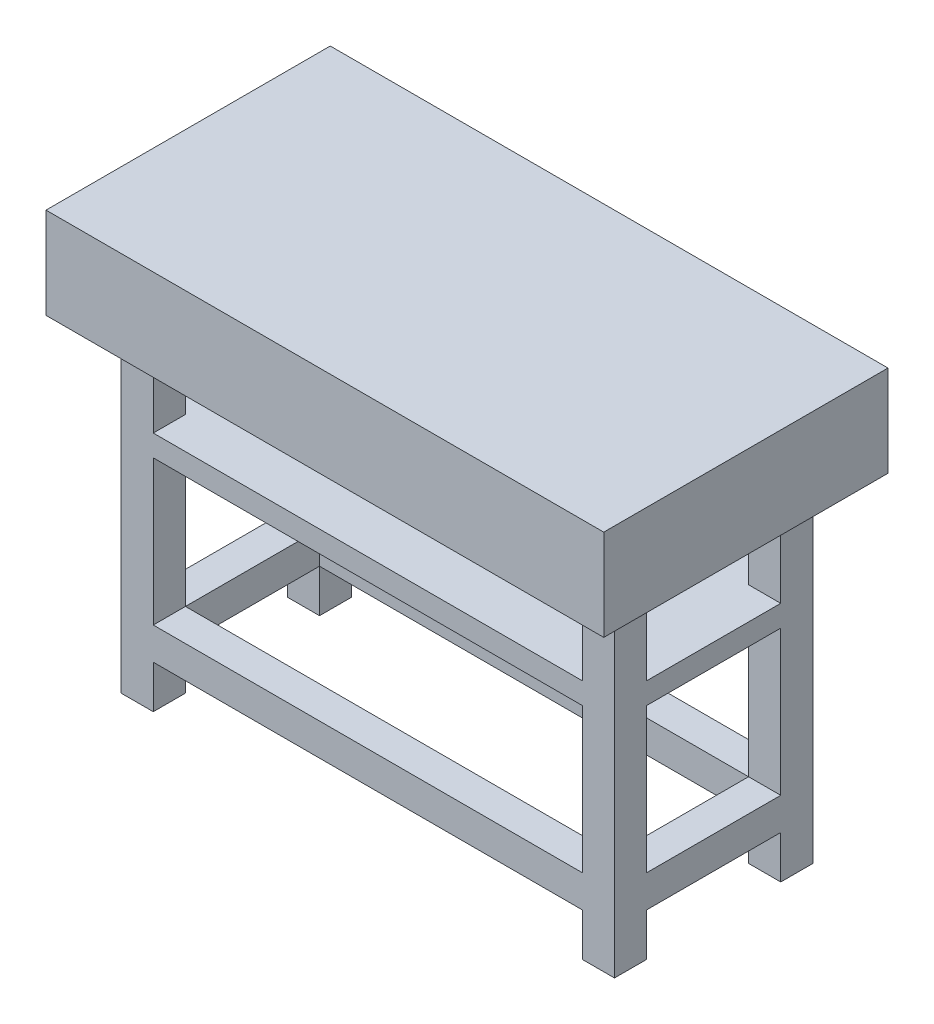
from build123d import *

# Parameters (mm, degrees)
SKETCH_2_W      = 1040
SKETCH_2_H      = 530
EXTRUDE_1_DEPTH = 170
SKETCH_3_W      = 800
SKETCH_3_H      = 60
SKETCH_3_W_2    = 60
SKETCH_3_H_2    = 410
EXTRUDE_2_DEPTH = 60
SKETCH_4_W      = 60
SKETCH_4_H      = 60
EXTRUDE_3_DEPTH = 560
EXTRUDE_4_REACH = 1274.046
SKETCH_5_W      = 60
SKETCH_5_H      = 60
SKETCH_5_H_2    = 40
EXTRUDE_5_REACH = 1231.512
SKETCH_6_W      = 60
SKETCH_6_H      = 60
EXTRUDE_6_REACH = 1231.512
SKETCH_7_W      = 370
SKETCH_7_H      = 40


with BuildPart() as part:
    # ｽｹｯﾁ2 → ﾎﾞｽ - 押し出し1 (new body)
    with BuildSketch(Plane(origin=(0, 0, 0), x_dir=(1, 0, 0), z_dir=(0, 1, 0))):
        with Locations((520, 265)):
            Rectangle(SKETCH_2_W, SKETCH_2_H)
    extrude(amount=EXTRUDE_1_DEPTH)

    # ｽｹｯﾁ3 → ﾎﾞｽ - 押し出し2 (add)
    with BuildSketch(Plane(origin=(0, 0, 0), x_dir=(-1, 0, 0), z_dir=(0, -1, 0))):
        with Locations((-520, 420)):
            Rectangle(SKETCH_3_W, SKETCH_3_H)
        with Locations((-950, 265)):
            Rectangle(SKETCH_3_W_2, SKETCH_3_H_2)
        with Locations((-520, 110)):
            Rectangle(SKETCH_3_W, SKETCH_3_H)
        with Locations((-90, 265)):
            Rectangle(SKETCH_3_W_2, SKETCH_3_H_2)
    extrude(amount=EXTRUDE_2_DEPTH)

    # ｽｹｯﾁ4 → ﾎﾞｽ - 押し出し3 (add)
    with BuildSketch(Plane(origin=(0, -60, 0), x_dir=(-1, 0, 0), z_dir=(0, -1, 0))):
        with Locations((-950, 420)):
            Rectangle(SKETCH_4_W, SKETCH_4_H)
        with Locations((-950, 110)):
            Rectangle(SKETCH_4_W, SKETCH_4_H)
        with Locations((-90, 420)):
            Rectangle(SKETCH_4_W, SKETCH_4_H)
        with Locations((-90, 110)):
            Rectangle(SKETCH_4_W, SKETCH_4_H)
    extrude(amount=EXTRUDE_3_DEPTH)

    # ｽｹｯﾁ5 → ﾎﾞｽ - 押し出し4 (add, up to next)
    with BuildSketch(Plane(origin=(0, 0, -140), x_dir=(-1, 0, 0), z_dir=(0, 0, -1)), mode=Mode.PRIVATE) as extrude_4_sk1:
        with Locations((-90, -510)):
            Rectangle(SKETCH_5_W, SKETCH_5_H)
    extrude_4_tool1 = extrude(extrude_4_sk1.sketch, amount=EXTRUDE_4_REACH, mode=Mode.PRIVATE) - part.part
    # ｽｹｯﾁ5 → ﾎﾞｽ - 押し出し4 (add, up to next)
    with BuildSketch(Plane(origin=(0, 0, -140), x_dir=(-1, 0, 0), z_dir=(0, 0, -1)), mode=Mode.PRIVATE) as extrude_4_sk2:
        with Locations((-950, -510)):
            Rectangle(SKETCH_5_W, SKETCH_5_H)
    extrude_4_tool2 = extrude(extrude_4_sk2.sketch, amount=EXTRUDE_4_REACH, mode=Mode.PRIVATE) - part.part
    # ｽｹｯﾁ5 → ﾎﾞｽ - 押し出し4 (add, up to next)
    with BuildSketch(Plane(origin=(0, 0, -140), x_dir=(-1, 0, 0), z_dir=(0, 0, -1)), mode=Mode.PRIVATE) as extrude_4_sk3:
        with Locations((-950, -190)):
            Rectangle(SKETCH_5_W, SKETCH_5_H_2)
    extrude_4_tool3 = extrude(extrude_4_sk3.sketch, amount=EXTRUDE_4_REACH, mode=Mode.PRIVATE) - part.part
    # ｽｹｯﾁ5 → ﾎﾞｽ - 押し出し4 (add, up to next)
    with BuildSketch(Plane(origin=(0, 0, -140), x_dir=(-1, 0, 0), z_dir=(0, 0, -1)), mode=Mode.PRIVATE) as extrude_4_sk4:
        with Locations((-90, -190)):
            Rectangle(SKETCH_5_W, SKETCH_5_H_2)
    extrude_4_tool4 = extrude(extrude_4_sk4.sketch, amount=EXTRUDE_4_REACH, mode=Mode.PRIVATE) - part.part
    add(extrude_4_tool1.solids().sort_by_distance((90, -510, -140))[0])
    add(extrude_4_tool2.solids().sort_by_distance((950, -510, -140))[0])
    add(extrude_4_tool3.solids().sort_by_distance((950, -190, -140))[0])
    add(extrude_4_tool4.solids().sort_by_distance((90, -190, -140))[0])

    # ｽｹｯﾁ6 → ﾎﾞｽ - 押し出し5 (add, up to next)
    with BuildSketch(Plane(origin=(120, 0, 0), x_dir=(0, 0, -1), z_dir=(1, 0, 0)), mode=Mode.PRIVATE) as extrude_5_sk1:
        with Locations((420, -510)):
            Rectangle(SKETCH_6_W, SKETCH_6_H)
    extrude_5_tool1 = extrude(extrude_5_sk1.sketch, amount=EXTRUDE_5_REACH, mode=Mode.PRIVATE) - part.part
    # ｽｹｯﾁ6 → ﾎﾞｽ - 押し出し5 (add, up to next)
    with BuildSketch(Plane(origin=(120, 0, 0), x_dir=(0, 0, -1), z_dir=(1, 0, 0)), mode=Mode.PRIVATE) as extrude_5_sk2:
        with Locations((110, -510)):
            Rectangle(SKETCH_6_W, SKETCH_6_H)
    extrude_5_tool2 = extrude(extrude_5_sk2.sketch, amount=EXTRUDE_5_REACH, mode=Mode.PRIVATE) - part.part
    add(extrude_5_tool1.solids().sort_by_distance((120, -510, -420))[0])
    add(extrude_5_tool2.solids().sort_by_distance((120, -510, -110))[0])

    # ｽｹｯﾁ7 → ﾎﾞｽ - 押し出し6 (add, up to next)
    with BuildSketch(Plane(origin=(120, 0, 0), x_dir=(0, 0, -1), z_dir=(1, 0, 0)), mode=Mode.PRIVATE) as extrude_6_sk1:
        with Locations((265, -190)):
            Rectangle(SKETCH_7_W, SKETCH_7_H)
    extrude_6_tool1 = extrude(extrude_6_sk1.sketch, amount=EXTRUDE_6_REACH, mode=Mode.PRIVATE) - part.part
    add(extrude_6_tool1.solids().sort_by_distance((120, -190, -265))[0])


solid = part.part
